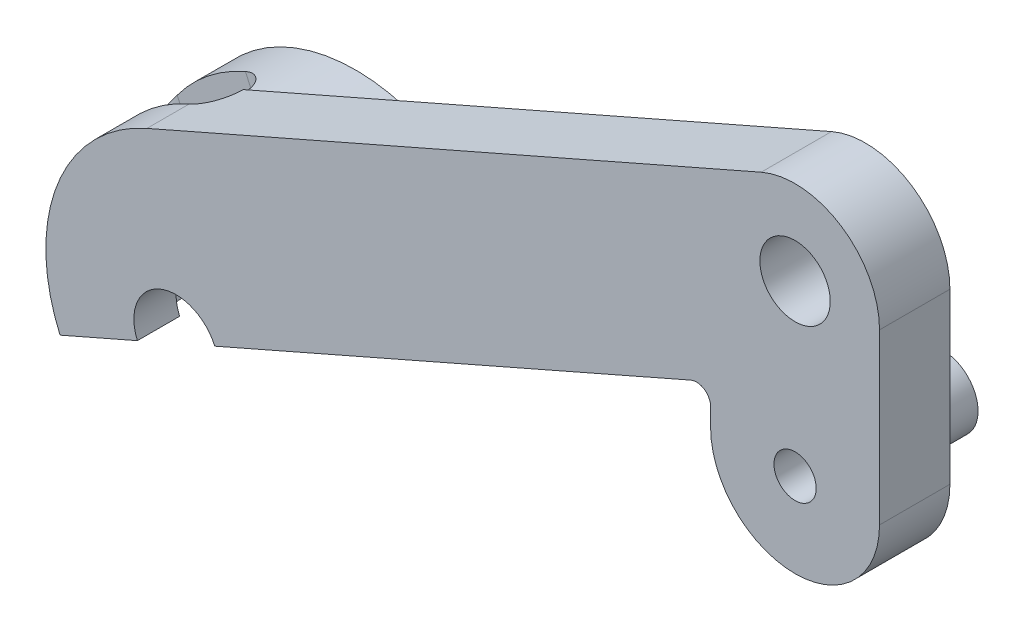
from build123d import *

# Parameters (mm, degrees)
ESBO_O7_R                = 2.5
RESSALTO_EXTRUS_O1_DEPTH = 5
ESBO_O8_R                = 2.5
RESSALTO_EXTRUS_O2_DEPTH = 5.5
ESBO_O9_R                = 1.5
CORTE_EXTRUS_O4_DEPTH    = 25
RESSALTO_EXTRUS_O3_START = 5
RESSALTO_EXTRUS_O3_DEPTH = 5
CORTE_EXTRUS_O5_DEPTH    = 16
SKETCH1_R                = 3.5
SKETCH1_R_2              = 2.5
BOSS_EXTRUDE1_DEPTH      = 0.5


with BuildPart() as part:
    # Esboço7 → Ressalto-extrusão1 (new body)
    with BuildSketch(Plane.XY):
        with BuildLine():
            Line((6, 0), (6, -12))
            ThreePointArc((6, -12), (0, -18), (-6, -12))
            Line((-6, -12), (-6, -10.710094321))
            ThreePointArc((-6, -10.710094321), (-6.452901427, -9.873026133), (-7.401366303, -9.794176699))
            Line((-7.401366303, -9.794176699), (-41.221941829, -24.614766505))
            ThreePointArc((-41.221941829, -24.614766505), (-45.173793605, -23.071112549), (-46.717447562, -27.022964325))
            Line((-46.717447562, -27.022964325), (-52.212953295, -29.431162145))
            ThreePointArc((-52.212953295, -29.431162145), (-52.399466586, -20.248653784), (-46.038337469, -13.62375504))
            Line((-46.038337469, -13.62375504), (-2.40819782, 5.495505733))
            ThreePointArc((-2.40819782, 5.495505733), (3.282591437, 5.022409129), (6, 0))
        make_face()
        Circle(ESBO_O7_R, mode=Mode.SUBTRACT)
    extrude(amount=RESSALTO_EXTRUS_O1_DEPTH)

    # Esboço8 → Ressalto-extrusão2 (add)
    with BuildSketch(Plane(origin=(0, 0, 0), x_dir=(-1, 0, 0), z_dir=(0, 0, -1))):
        with Locations(Location((0, -12, 0), (0, 0, 180))):
            Circle(ESBO_O8_R)
    extrude(amount=RESSALTO_EXTRUS_O2_DEPTH)

    # Esboço9 → Corte-extrusão4 (cut)
    with BuildSketch(Plane(origin=(0, 0, -5.5), x_dir=(-1, 0, 0), z_dir=(0, 0, -1))):
        with Locations((0, -12)):
            Circle(ESBO_O9_R)
    extrude(amount=-CORTE_EXTRUS_O4_DEPTH, mode=Mode.SUBTRACT)

    # Esboço10 → Ressalto-extrusão3 (add)
    with BuildSketch(Plane(origin=(0, 0, 0), x_dir=(-1, 0, 0), z_dir=(0, 0, -1)).offset(RESSALTO_EXTRUS_O3_START)):
        with BuildLine():
            Line((46.717447562, -27.022964325), (52.212953295, -29.431162145))
            ThreePointArc((52.212953295, -29.431162145), (46.038337469, -13.62375504), (30.230930363, -19.798370866))
            Line((30.230930363, -19.798370866), (41.221941829, -24.614766505))
            ThreePointArc((41.221941829, -24.614766505), (45.173793605, -23.071112549), (46.717447562, -27.022964325))
        make_face()
    extrude(amount=-RESSALTO_EXTRUS_O3_DEPTH)

    # Esboço11 → Corte-extrusão5 (cut)
    with BuildSketch(Plane(origin=(-2.40819782, 5.495505733, 0), x_dir=(-0.9159176221486778, -0.40136630331595097, 0), z_dir=(-0.40136630331595097, 0.9159176221486778, 0))):
        with BuildLine():
            Line((47.63544078, 2), (53.63544078, 2))
            ThreePointArc((53.63544078, 2), (55.63544078, 0), (53.63544078, -2))
            Line((53.63544078, -2), (47.63544078, -2))
            ThreePointArc((47.63544078, -2), (45.63544078, 0), (47.63544078, 2))
        make_face()
    extrude(amount=-CORTE_EXTRUS_O5_DEPTH, mode=Mode.SUBTRACT)

    # Sketch1 → Boss-Extrude1 (add)
    with BuildSketch(Plane(origin=(0, 0, 0), x_dir=(-1, 0, 0), z_dir=(0, 0, -1))):
        with Locations(Location((0, -12, 0), (0, 0, 180))):
            Circle(SKETCH1_R)
        with Locations((0, -12)):
            Circle(SKETCH1_R_2, mode=Mode.SUBTRACT)
    extrude(amount=BOSS_EXTRUDE1_DEPTH)


solid = part.part
